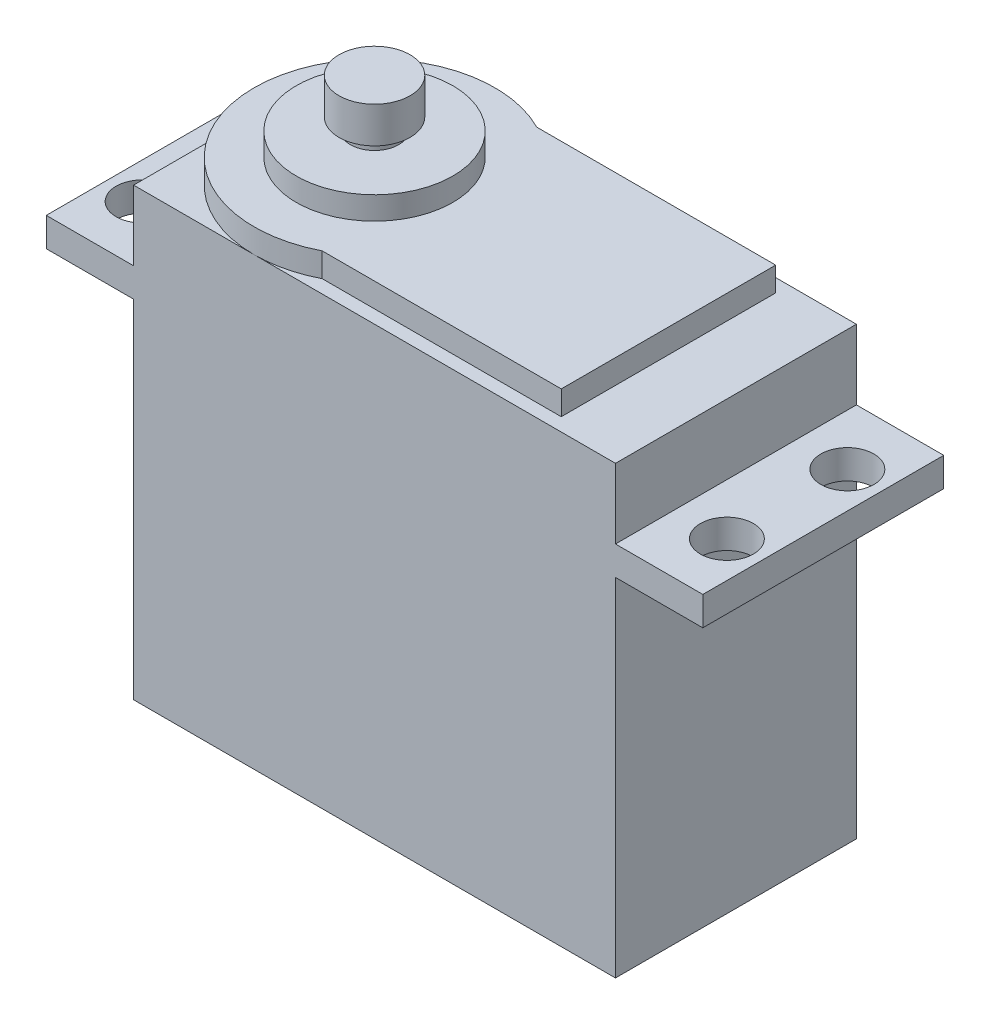
from build123d import *

# Parameters (mm, degrees)
SKETCH_1_W      = 40
SKETCH_1_H      = 20
EXTRUDE_1_DEPTH = 37
EXTRUDE_START   = -5.8
SKETCH_2_W      = 54.5
SKETCH_2_H      = 20
SKETCH_2_R      = 2.2
EXTRUDE_2_DEPTH = 2.4
EXTRUDE_3_DEPTH = 2
SKETCH_4_R      = 6.5
EXTRUDE_4_DEPTH = 1.9
SKETCH_5_R      = 2
EXTRUDE_5_DEPTH = 4
SKETCH_6_R      = 2.95
EXTRUDE_6_DEPTH = 3


with BuildPart() as part:
    # 草图1 → 凸台-拉伸1 (new body)
    with BuildSketch(Plane(origin=(0, 0, 0), x_dir=(1, 0, 0), z_dir=(0, 1, 0))):
        Rectangle(SKETCH_1_W, SKETCH_1_H)
    extrude(amount=EXTRUDE_1_DEPTH)

    # 草图2 → 凸台-拉伸2 (add)
    with BuildSketch(Plane(origin=(0, 37, 0), x_dir=(1, 0, 0), z_dir=(0, 1, 0)).offset(EXTRUDE_START)):
        Rectangle(SKETCH_2_W, SKETCH_2_H)
        with Locations(Location((24.25, 5, 0), (0, 0, 270))):
            Circle(SKETCH_2_R, mode=Mode.SUBTRACT)
        with Locations(Location((24.25, -5, 0), (0, 0, 270))):
            Circle(SKETCH_2_R, mode=Mode.SUBTRACT)
        with Locations(Location((-24.25, 5, 0), (0, 0, 270))):
            Circle(SKETCH_2_R, mode=Mode.SUBTRACT)
        with Locations(Location((-24.25, -5, 0), (0, 0, 270))):
            Circle(SKETCH_2_R, mode=Mode.SUBTRACT)
    extrude(amount=-EXTRUDE_2_DEPTH)

    # 草图3 → 凸台-拉伸3 (add)
    with BuildSketch(Plane(origin=(0, 37, 0), x_dir=(1, 0, 0), z_dir=(0, 1, 0))):
        with BuildLine():
            Line((-5.440394754, 8.9), (14.4, 8.9))
            Line((14.4, 8.9), (14.4, -8.9))
            Line((14.4, -8.9), (-5.440394754, -8.9))
            ThreePointArc((-5.440394754, -8.9), (-20, 0), (-5.440394754, 8.9))
        make_face()
    extrude(amount=EXTRUDE_3_DEPTH)

    # 草图4 → 凸台-拉伸4 (add)
    with BuildSketch(Plane(origin=(0, 39, 0), x_dir=(1, 0, 0), z_dir=(0, 1, 0))):
        with Locations(Location((-10, 0, 0), (0, 0, 90))):
            Circle(SKETCH_4_R)
    extrude(amount=EXTRUDE_4_DEPTH)

    # 草图5 → 凸台-拉伸5 (add)
    with BuildSketch(Plane(origin=(0, 40.9, 0), x_dir=(1, 0, 0), z_dir=(0, 1, 0))):
        with Locations(Location((-10, 0, 0), (0, 0, 270))):
            Circle(SKETCH_5_R)
    extrude(amount=EXTRUDE_5_DEPTH)

    # 草图6 → 凸台-拉伸6 (add)
    with BuildSketch(Plane(origin=(0, 44.9, 0), x_dir=(1, 0, 0), z_dir=(0, 1, 0))):
        with Locations(Location((-10, 0, 0), (0, 0, 270))):
            Circle(SKETCH_6_R)
    extrude(amount=-EXTRUDE_6_DEPTH)


solid = part.part
